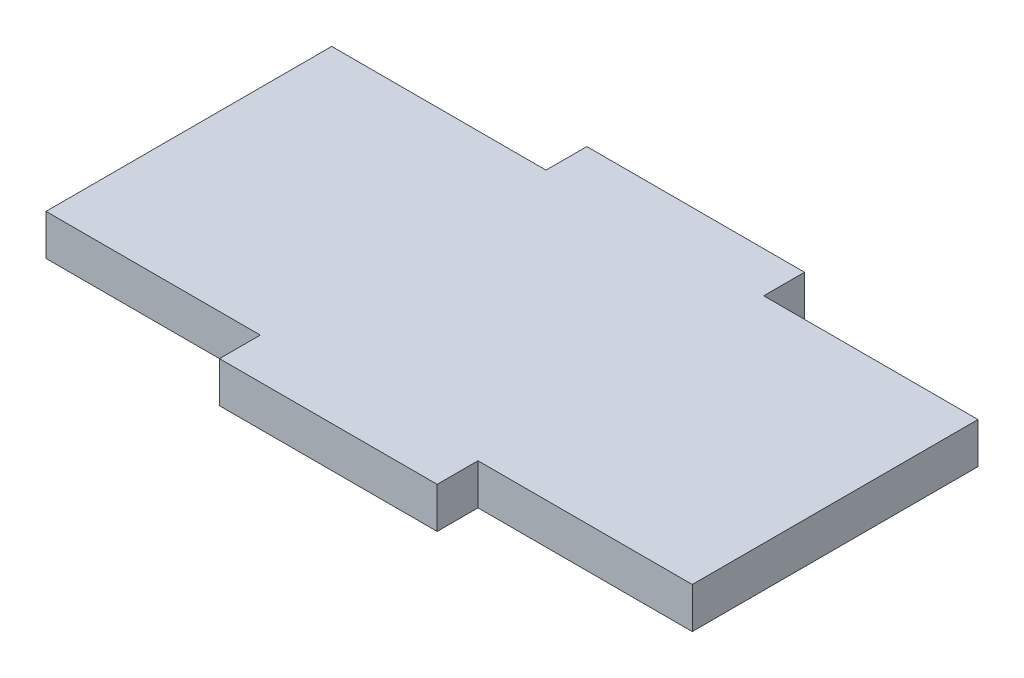
from build123d import *

# Parameters (mm, degrees)
SALIENTE_EXTRUIR1_DEPTH = 3


with BuildPart() as part:
    # Croquis1 → Saliente-Extruir1 (new body)
    with BuildSketch(Plane(origin=(0, 0, 0), x_dir=(1, 0, 0), z_dir=(0, 1, 0))):
        Polygon((-31.75, 0), (-31.75, 3), (-47.5, 3), (-47.5, 24), (-31.75, 24), (-31.75, 27), (-15.75, 27), (-15.75, 24), (0, 24), (0, 3), (-15.75, 3), (-15.75, 0), align=None)
    extrude(amount=SALIENTE_EXTRUIR1_DEPTH)


solid = part.part
